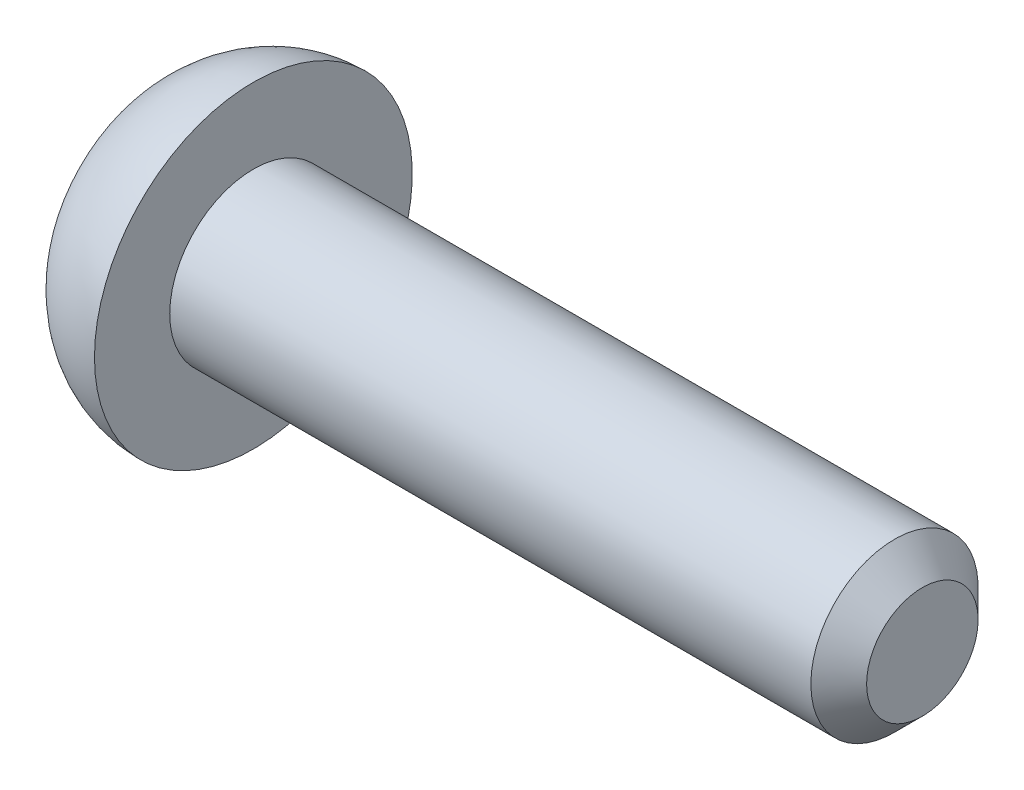
from build123d import *

# Parameters (mm, degrees)
CHAMFER1_SIZE      = 0.5
CUT_EXTRUDE1_DEPTH = 1


with BuildPart() as part:
    # Sketch2 → Revolve1 (revolve)
    with BuildSketch(Plane(origin=(0, 0, 0), x_dir=(1, 0, 0), z_dir=(0, 1, 0)), mode=Mode.PRIVATE) as revolve1_sk:
        with BuildLine():
            Line((0, 0), (0, 1.5))
            Line((0, 1.5), (-12, 1.5))
            Line((-12, 1.5), (-12, 2.85))
            ThreePointArc((-12, 2.85), (-12.917065968, 2.639177072), (-13.65, 2.049038106))
            Line((-13.65, 2.049038106), (-13.65, 0))
            Line((-13.65, 0), (0, 0))
        make_face()
    revolve(revolve1_sk.sketch.rotate(Axis((-13.65, 0, 0), (1, 0, 0)), 180), axis=Axis((-13.65, 0, 0), (1, 0, 0)))

    # Chamfer1
    chamfer1_edges = [part.edges().sort_by_distance(p)[0] for p in [
        (0, 0, -1.5),
    ]]
    chamfer(chamfer1_edges, length=CHAMFER1_SIZE)

    # Sketch4 → Cut-Extrude1 (cut)
    with BuildSketch(Plane.ZY.offset(13.65)):
        with BuildLine():
            ThreePointArc((-1.342027284, 0.090739778), (-0.883315009, 0.509982158), (-0.749596595, 1.116859832))
            ThreePointArc((-0.749596595, 1.116859832), (-0.7, 1.212435565), (-0.592430689, 1.20759961))
            ThreePointArc((-0.592430689, 1.20759961), (0, 1.019964317), (0.592430689, 1.20759961))
            ThreePointArc((0.592430689, 1.20759961), (0.7, 1.212435565), (0.749596595, 1.116859832))
            ThreePointArc((0.749596595, 1.116859832), (0.883315009, 0.509982158), (1.342027284, 0.090739778))
            ThreePointArc((1.342027284, 0.090739778), (1.4, 0), (1.342027284, -0.090739778))
            ThreePointArc((1.342027284, -0.090739778), (0.883315009, -0.509982158), (0.749596595, -1.116859832))
            ThreePointArc((0.749596595, -1.116859832), (0.7, -1.212435565), (0.592430689, -1.20759961))
            ThreePointArc((0.592430689, -1.20759961), (0, -1.019964317), (-0.592430689, -1.20759961))
            ThreePointArc((-0.592430689, -1.20759961), (-0.7, -1.212435565), (-0.749596595, -1.116859832))
            ThreePointArc((-0.749596595, -1.116859832), (-0.883315009, -0.509982158), (-1.342027284, -0.090739778))
            ThreePointArc((-1.342027284, -0.090739778), (-1.4, 0), (-1.342027284, 0.090739778))
        make_face()
    extrude(amount=-CUT_EXTRUDE1_DEPTH, mode=Mode.SUBTRACT)


solid = part.part
